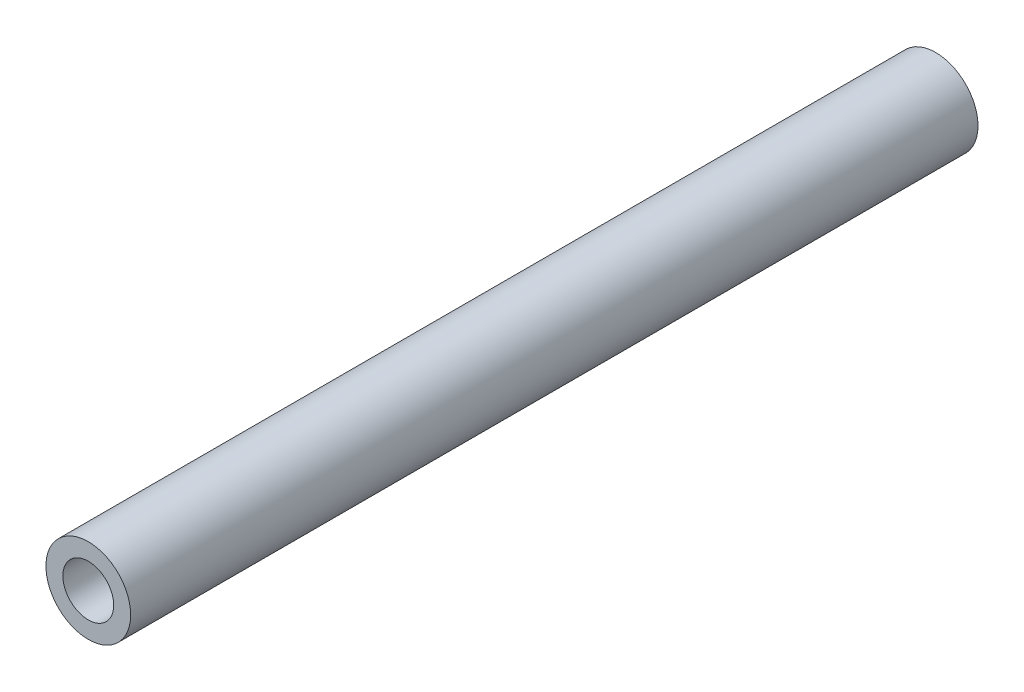
from build123d import *

# Parameters (mm, degrees)
SKETCH1_R           = 2.5
BOSS_EXTRUDE2_DEPTH = 50
SKETCH2_R           = 1.5
CUT_EXTRUDE1_DEPTH  = 6
CUT_EXTRUDE2_START  = -6
SKETCH3_R           = 1.5
CUT_EXTRUDE2_DEPTH  = 6


with BuildPart() as part:
    # Sketch1 → Boss-Extrude2 (new body)
    with BuildSketch(Plane.XY):
        Circle(SKETCH1_R)
    extrude(amount=BOSS_EXTRUDE2_DEPTH)

    # Sketch2 → Cut-Extrude1 (cut)
    with BuildSketch(Plane.XY.offset(50)):
        Circle(SKETCH2_R)
    extrude(amount=-CUT_EXTRUDE1_DEPTH, mode=Mode.SUBTRACT)

    # Sketch3 → Cut-Extrude2 (cut)
    with BuildSketch(Plane(origin=(0, 0, 0), x_dir=(-1, 0, 0), z_dir=(0, 0, -1)).offset(CUT_EXTRUDE2_START)):
        with Locations(Location((0, 0, 0), (0, 0, 180))):
            Circle(SKETCH3_R)
    extrude(amount=CUT_EXTRUDE2_DEPTH, mode=Mode.SUBTRACT)


solid = part.part
